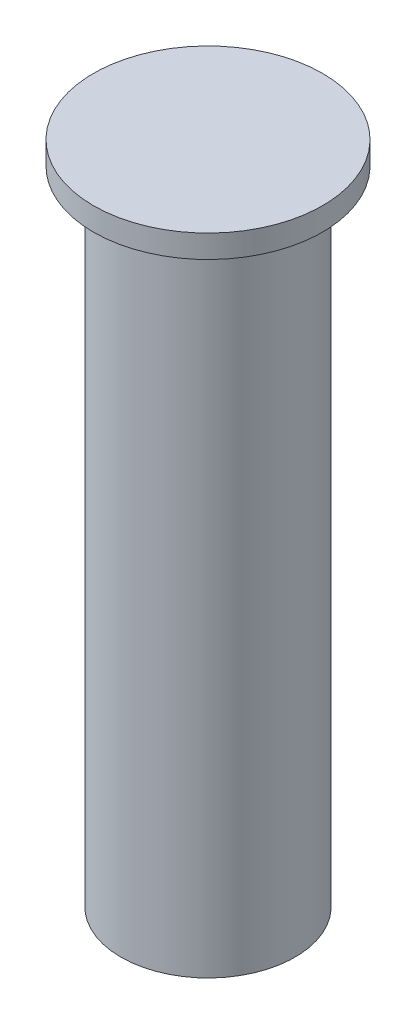
from build123d import *

# Parameters (mm, degrees)
SKETCH1_R           = 190
BOSS_EXTRUDE1_DEPTH = 1400
SKETCH2_R           = 250
BOSS_EXTRUDE2_DEPTH = 50


with BuildPart() as part:
    # Sketch1 → Boss-Extrude1 (new body)
    with BuildSketch(Plane(origin=(0, 0, 0), x_dir=(1, 0, 0), z_dir=(0, 1, 0))):
        with Locations(Location((0, 0, 0), (0, 0, 270))):
            Circle(SKETCH1_R)
    extrude(amount=BOSS_EXTRUDE1_DEPTH)

    # Sketch2 → Boss-Extrude2 (add)
    with BuildSketch(Plane(origin=(0, 1400, 0), x_dir=(1, 0, 0), z_dir=(0, 1, 0))):
        with Locations(Location((0, 0, 0), (0, 0, 270))):
            Circle(SKETCH2_R)
    extrude(amount=BOSS_EXTRUDE2_DEPTH)


solid = part.part
